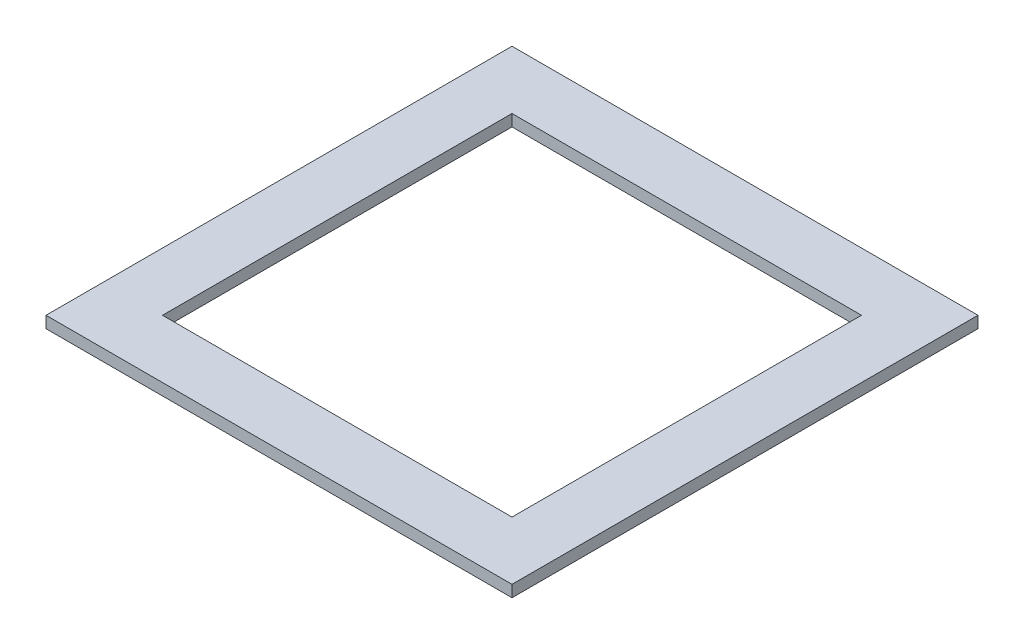
from build123d import *

# Parameters (mm, degrees)
CROQUIS1_W              = 20
CROQUIS1_H              = 20
CROQUIS1_W_2            = 15
CROQUIS1_H_2            = 15
SALIENTE_EXTRUIR1_DEPTH = 0.5


with BuildPart() as part:
    # Croquis1 → Saliente-Extruir1 (new body)
    with BuildSketch(Plane(origin=(0, 0, 0), x_dir=(1, 0, 0), z_dir=(0, 1, 0))):
        with Locations((7.5, 7.5)):
            Rectangle(CROQUIS1_W, CROQUIS1_H)
        with Locations((7.5, 7.5)):
            Rectangle(CROQUIS1_W_2, CROQUIS1_H_2, mode=Mode.SUBTRACT)
    extrude(amount=SALIENTE_EXTRUIR1_DEPTH)


solid = part.part
